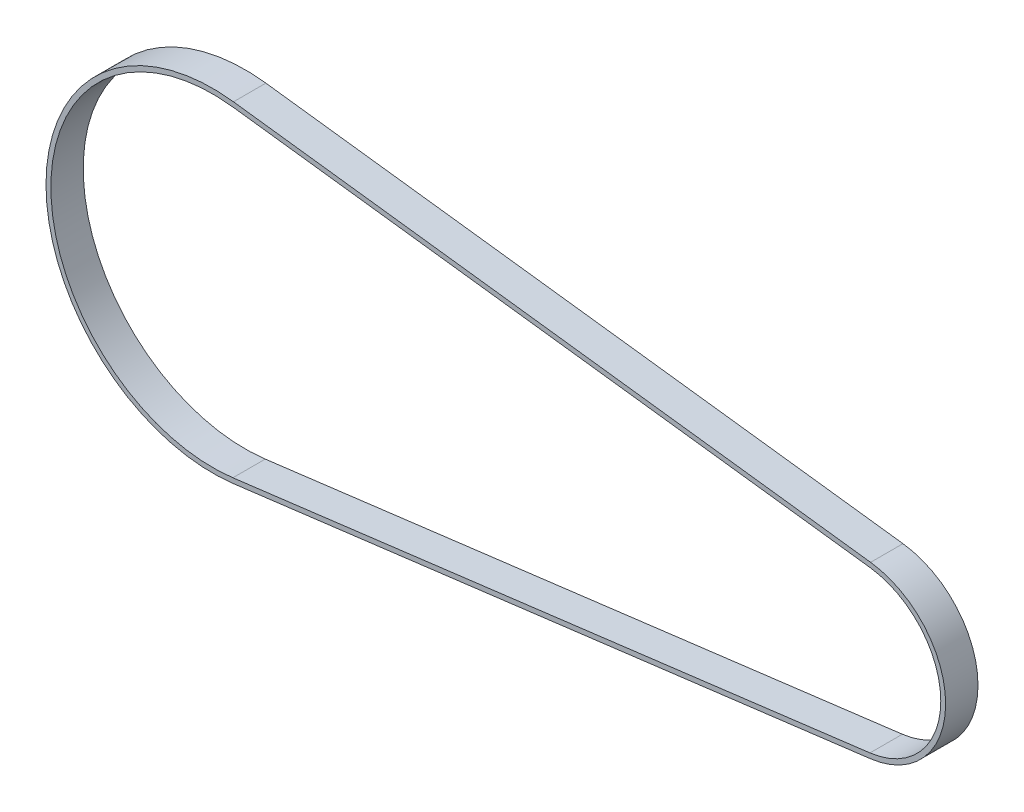
from build123d import *

# Parameters (mm, degrees)
EXTRUDE_1_DEPTH = 10


with BuildPart() as part:
    # 草图1 → 拉伸-薄壁1 (new, symmetric)
    with BuildSketch(Plane.XY):
        with BuildLine():
            Line((6.625, -52.584307307), (-387.125, -102.19214439))
            ThreePointArc((-387.125, -102.19214439), (-503, 0), (-387.125, 102.19214439))
            Line((-387.125, 102.19214439), (6.625, 52.584307307))
            ThreePointArc((6.625, 52.584307307), (53, 0), (6.625, -52.584307307))
        make_face()
        with BuildLine():
            Line((6.25, -49.607837082), (-387.5, -99.215674165))
            ThreePointArc((-387.5, -99.215674165), (-500, 0), (-387.5, 99.215674165))
            Line((-387.5, 99.215674165), (6.25, 49.607837082))
            ThreePointArc((6.25, 49.607837082), (50, 0), (6.25, -49.607837082))
        make_face(mode=Mode.SUBTRACT)
    extrude(amount=EXTRUDE_1_DEPTH, both=True)


solid = part.part
